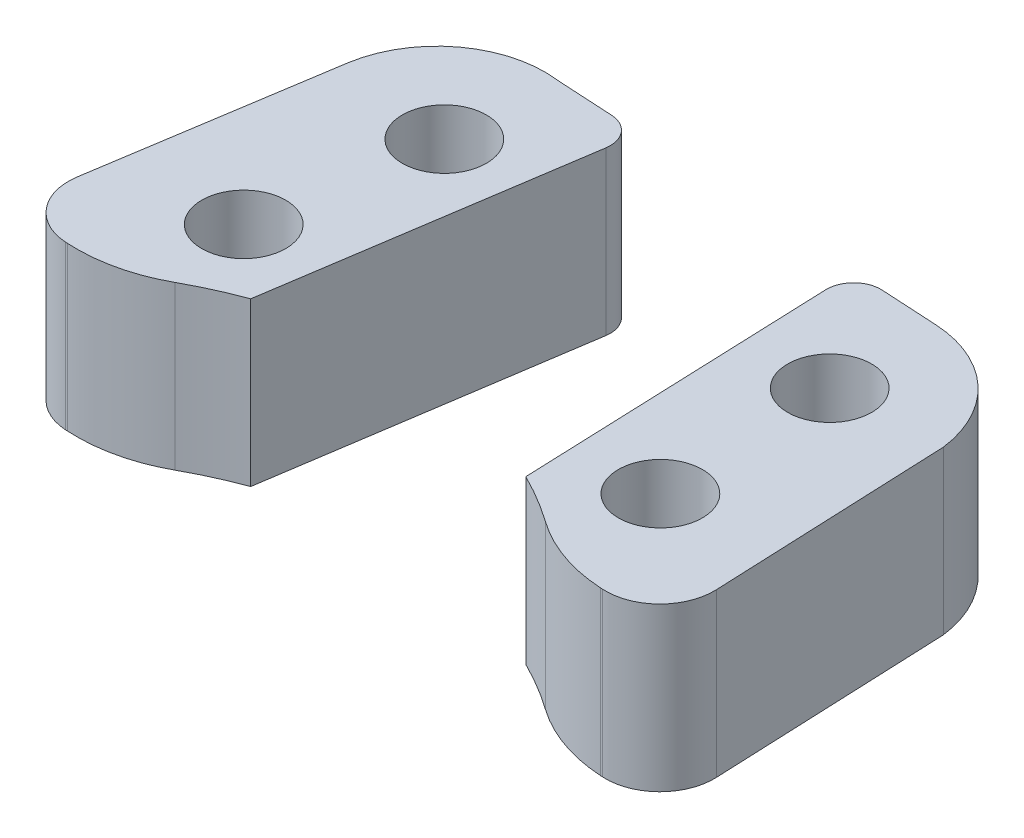
from build123d import *

# Parameters (mm, degrees)
DODANIE_WYCI_GNI_CIE1_DEPTH   = 6
DODANIE_WYCI_GNI_CIE1_2_DEPTH = 6
SZKIC2_R                      = 1.55
WYTNIJ_WYCI_GNI_CIE1_DEPTH    = 6


with BuildPart() as part:
    # Szkic1 → Dodanie-wyciągnięcie1 (new body)
    with BuildSketch(Plane.XZ.offset(18.873993717)):
        with BuildLine():
            Line((-376.560022787, 71.092821297), (-374.831151718, 59.714534639))
            ThreePointArc((-374.831151718, 59.714534639), (-375.043393456, 58.934086873), (-375.763520627, 58.565899246))
            Line((-375.763520627, 58.565899246), (-377.463219092, 58.470082214))
            Line((-377.463219092, 58.470082214), (-377.867323557, 58.44730165))
            ThreePointArc((-377.867323557, 58.44730165), (-380.752416846, 59.195478513), (-382.306249359, 61.738928222))
            Line((-382.306249359, 61.738928222), (-383.655439175, 70.389689128))
            ThreePointArc((-383.655439175, 70.389689128), (-383.234620063, 71.955292457), (-381.791895571, 72.694716929))
            Line((-381.791895571, 72.694716929), (-381.713251764, 72.699150313))
            ThreePointArc((-381.713251764, 72.699150313), (-380.046026471, 72.55950463), (-378.482176857, 71.964932953))
            ThreePointArc((-378.482176857, 71.964932953), (-377.5379525, 71.491733437), (-376.560022787, 71.092821297))
        make_face()
    extrude(amount=-DODANIE_WYCI_GNI_CIE1_DEPTH)


with BuildPart() as body_2:
    # Szkic1 → Dodanie-wyci_gni_cie1 2 (new body)
    with BuildSketch(Plane.XZ.offset(18.873993717)):
        with BuildLine():
            Line((-366.240537331, 60.198833989), (-365.801162735, 71.699496113))
            ThreePointArc((-365.801162735, 71.699496113), (-364.874458275, 72.205709794), (-363.989579114, 72.781923572))
            ThreePointArc((-363.989579114, 72.781923572), (-362.502460733, 73.548487343), (-360.861493062, 73.874625653))
            Line((-360.861493062, 73.874625653), (-360.782849254, 73.879059037))
            ThreePointArc((-360.782849254, 73.879059037), (-359.266162416, 73.306465339), (-358.67205327, 71.798076519))
            Line((-358.67205327, 71.798076519), (-359.040446779, 63.050490359))
            ThreePointArc((-359.040446779, 63.050490359), (-360.378861081, 60.434579133), (-363.081307119, 59.280833149))
            Line((-363.081307119, 59.280833149), (-363.485411585, 59.258052584))
            Line((-363.485411585, 59.258052584), (-365.184982719, 59.162242731))
            ThreePointArc((-365.184982719, 59.162242731), (-365.941935052, 59.447170815), (-366.240537331, 60.198833989))
        make_face()
    extrude(amount=-DODANIE_WYCI_GNI_CIE1_2_DEPTH)


with BuildPart() as wytnij_wyci_gni_cie1_tool:
    # Szkic2 → Wytnij-wyciągnięcie1 (new body)
    with BuildSketch(Plane(origin=(0, -12.873993717, 0), x_dir=(-1, 0, 0), z_dir=(0, 1, 0))):
        with Locations(Location((378.091035143, 62.415721781, 0), (0, 0, 90))):
            Circle(SZKIC2_R)
        with Locations(Location((379.067604175, 68.841942515, 0), (0, 0, 90))):
            Circle(SZKIC2_R)
        with Locations(Location((363.021125314, 63.265257191, 0), (0, 0, 90))):
            Circle(SZKIC2_R)
        with Locations(Location((362.772978476, 69.760518782, 0), (0, 0, 90))):
            Circle(SZKIC2_R)
    extrude(amount=-WYTNIJ_WYCI_GNI_CIE1_DEPTH)


with BuildPart() as part_1:
    add(part.part)

    # Wytnij-wyciągnięcie1: cut by wytnij_wyci_gni_cie1_tool
    add(wytnij_wyci_gni_cie1_tool.part, mode=Mode.SUBTRACT)


with BuildPart() as body_2_1:
    add(body_2.part)

    # Wytnij-wyciągnięcie1: cut by wytnij_wyci_gni_cie1_tool
    add(wytnij_wyci_gni_cie1_tool.part, mode=Mode.SUBTRACT)


solid = Compound([part_1.part, body_2_1.part])
